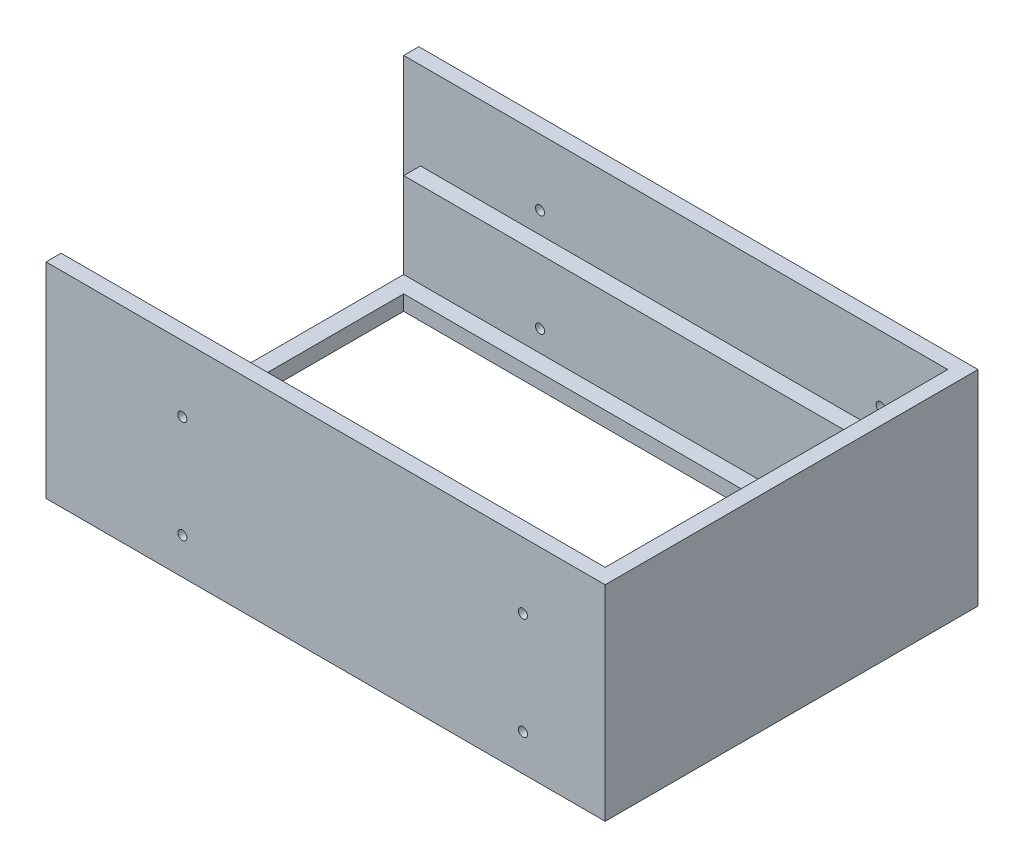
from build123d import *

# Parameters (mm, degrees)
SKETCH1_W                     = 166.5
SKETCH1_H                     = 111
BOSS_EXTRUDE1_DEPTH           = 30.5
SHELL1_T                      = -4.5
CUT_EXTRUDE1_REACH            = 105.377
SKETCH2_W                     = 157
SKETCH2_H                     = 92
TAP_DRILL_FOR_6_32_TAP1_D     = 2.7051
TAP_DRILL_FOR_6_32_TAP1_DEPTH = 4.5
LPATTERN1_COUNT               = 2
LPATTERN1_PITCH               = 30.5
SKETCH7_W                     = 102
SKETCH7_H                     = 4.5
CUT_EXTRUDE2_DEPTH            = 5
CUT_EXTRUDE3_START            = -157
CUT_EXTRUDE3_DEPTH            = 157


with BuildPart() as part:
    # Sketch1 → Boss-Extrude1 (new body)
    with BuildSketch(Plane(origin=(0, 0, 0), x_dir=(1, 0, 0), z_dir=(0, 1, 0))):
        Rectangle(SKETCH1_W, SKETCH1_H)
    extrude(amount=BOSS_EXTRUDE1_DEPTH)

    # Shell1
    shell1_openings = [part.faces().sort_by_distance(p)[0] for p in [
        (0, 30.5, 0),
        (-83.25, 15.25, 0),
    ]]
    offset(amount=SHELL1_T, openings=shell1_openings, kind=Kind.INTERSECTION)

    # Sketch2 → Cut-Extrude1 (cut, up to next)
    with BuildSketch(Plane(origin=(0, 4.5, 0), x_dir=(1, 0, 0), z_dir=(0, 1, 0)), mode=Mode.PRIVATE) as cut_extrude1_sk1:
        with Locations((0.25, 0)):
            Rectangle(SKETCH2_W, SKETCH2_H)
    cut_extrude1_tool1 = extrude(cut_extrude1_sk1.sketch, amount=-CUT_EXTRUDE1_REACH, mode=Mode.PRIVATE) & part.part
    add(cut_extrude1_tool1.solids().sort_by_distance((0.25, 4.5, 0))[0], mode=Mode.SUBTRACT)

    # Tap Drill for #6-32 Tap1
    with Locations(Plane(origin=(0, 0, -55.5), x_dir=(-1, 0, 0), z_dir=(0, 0, -1))):
        with Locations((42.66, 10.84), (-58.75, 10.84)):
            tap_drill_for_6_32_tap1 = Hole(TAP_DRILL_FOR_6_32_TAP1_D / 2, depth=TAP_DRILL_FOR_6_32_TAP1_DEPTH)

    # Mirror1: Tap Drill for #6-32 Tap1 across plane
    add(tap_drill_for_6_32_tap1.mirror(Plane.XY), mode=Mode.SUBTRACT)


with BuildPart() as lpattern1_1:
    # LPattern1: pattern copy
    add(part.part.moved(Location(Vector(0, 1, 0) * (1 * LPATTERN1_PITCH))))


with BuildPart() as part_1:
    add(part.part)

    # Combine1: union LPattern1_1
    add(lpattern1_1.part)

    # Sketch7 → Cut-Extrude2 (cut)
    with BuildSketch(Plane.ZY.offset(83.25)):
        with Locations((0, 32.75)):
            Rectangle(SKETCH7_W, SKETCH7_H)
    extrude(amount=-CUT_EXTRUDE2_DEPTH, mode=Mode.SUBTRACT)

    # Sketch8 → Cut-Extrude3 (cut)
    with BuildSketch(Plane.ZY.offset(78.25).offset(CUT_EXTRUDE3_START)):
        Polygon((-51, 30.5), (-46, 35), (-46, 30.5), align=None)
        Polygon((51, 30.5), (46, 30.5), (46, 35), align=None)
    extrude(amount=CUT_EXTRUDE3_DEPTH, mode=Mode.SUBTRACT)


solid = part_1.part
